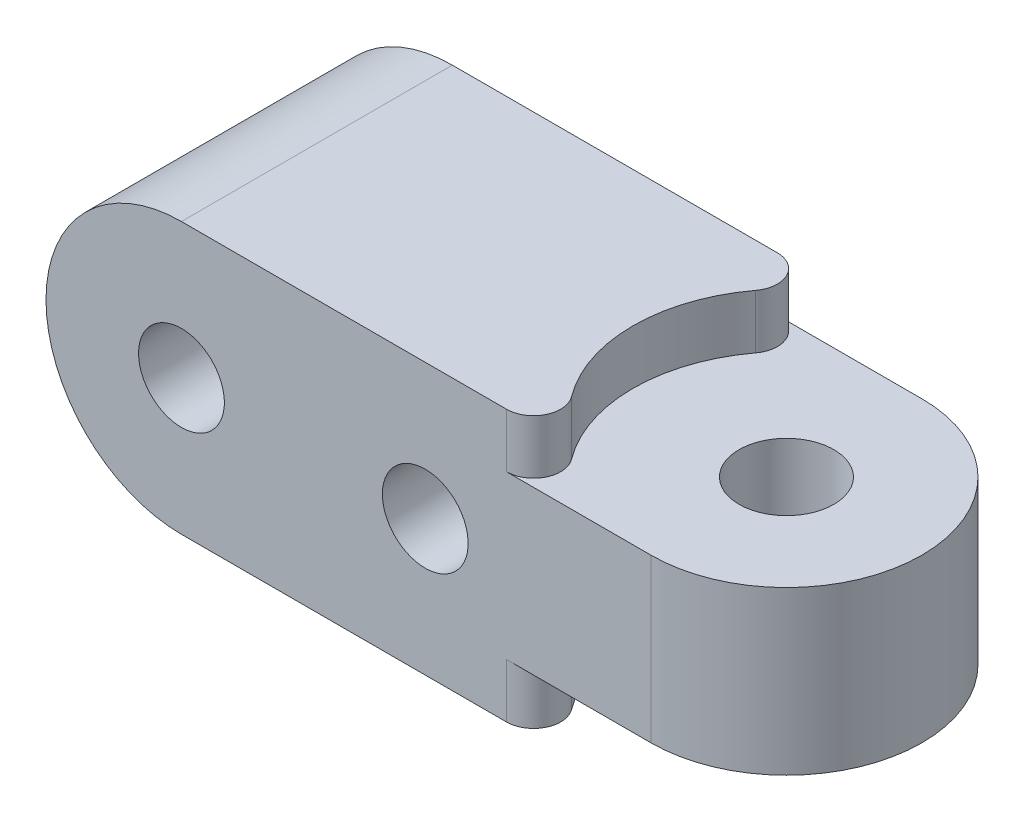
from build123d import *

# Parameters (mm, degrees)
SKETCH1_R                = 0.525
BOSS_EXTRUDE1_DEPTH      = 0.9
BOSS_EXTRUDE2_DEPTH      = 1.5
M1_2X0_25_TAPPED_HOLE1_D = 0.95
CUT_EXTRUDE1_DEPTH       = 7.442049363


with BuildPart() as part:
    # Sketch1 → Boss-Extrude1 (new, symmetric)
    with BuildSketch(Plane(origin=(0, 0, 0), x_dir=(1, 0, 0), z_dir=(0, 1, 0))):
        with BuildLine():
            ThreePointArc((2.64, -1.02), (2.668328157, -1.334164079), (2.4, -1.5))
            Line((2.4, -1.5), (4, -1.5))
            ThreePointArc((4, -1.5), (5.5, 0), (4, 1.5))
            Line((4, 1.5), (2.4, 1.5))
            ThreePointArc((2.4, 1.5), (2.668328157, 1.334164079), (2.64, 1.02))
            ThreePointArc((2.64, 1.02), (2.3, 0), (2.64, -1.02))
        make_face()
        with Locations((4, 0)):
            Circle(SKETCH1_R, mode=Mode.SUBTRACT)
    extrude(amount=BOSS_EXTRUDE1_DEPTH, both=True)

    # Sketch1<4> → Boss-Extrude2 (add, symmetric)
    with BuildSketch(Plane(origin=(0, 0, 0), x_dir=(1, 0, 0), z_dir=(0, 1, 0))):
        with BuildLine():
            Line((-4, 1.5), (-4, -1.5))
            Line((-4, -1.5), (2.4, -1.5))
            ThreePointArc((2.4, -1.5), (2.668328157, -1.334164079), (2.64, -1.02))
            ThreePointArc((2.64, -1.02), (2.3, 0), (2.64, 1.02))
            ThreePointArc((2.64, 1.02), (2.668328157, 1.334164079), (2.4, 1.5))
            Line((2.4, 1.5), (-4, 1.5))
        make_face()
    extrude(amount=BOSS_EXTRUDE2_DEPTH, both=True)

    # M1.2x0.25 Tapped Hole1 (through all)
    with Locations(Plane(origin=(0, 0, -1.5), x_dir=(-1, 0, 0), z_dir=(0, 0, -1))):
        with Locations((-1.5, 0), (1.2, 0)):
            Hole(M1_2X0_25_TAPPED_HOLE1_D / 2)

    # Sketch5 → Cut-Extrude1 (cut, through all)
    with BuildSketch(Plane(origin=(0, 0, -1.5), x_dir=(-1, 0, 0), z_dir=(0, 0, -1))):
        with BuildLine():
            Line((1.2, 1.5), (4, 1.5))
            Line((4, 1.5), (4, -1.5))
            Line((4, -1.5), (1.2, -1.5))
            ThreePointArc((1.2, -1.5), (2.7, 0), (1.2, 1.5))
        make_face()
    extrude(amount=-CUT_EXTRUDE1_DEPTH, mode=Mode.SUBTRACT)


solid = part.part
